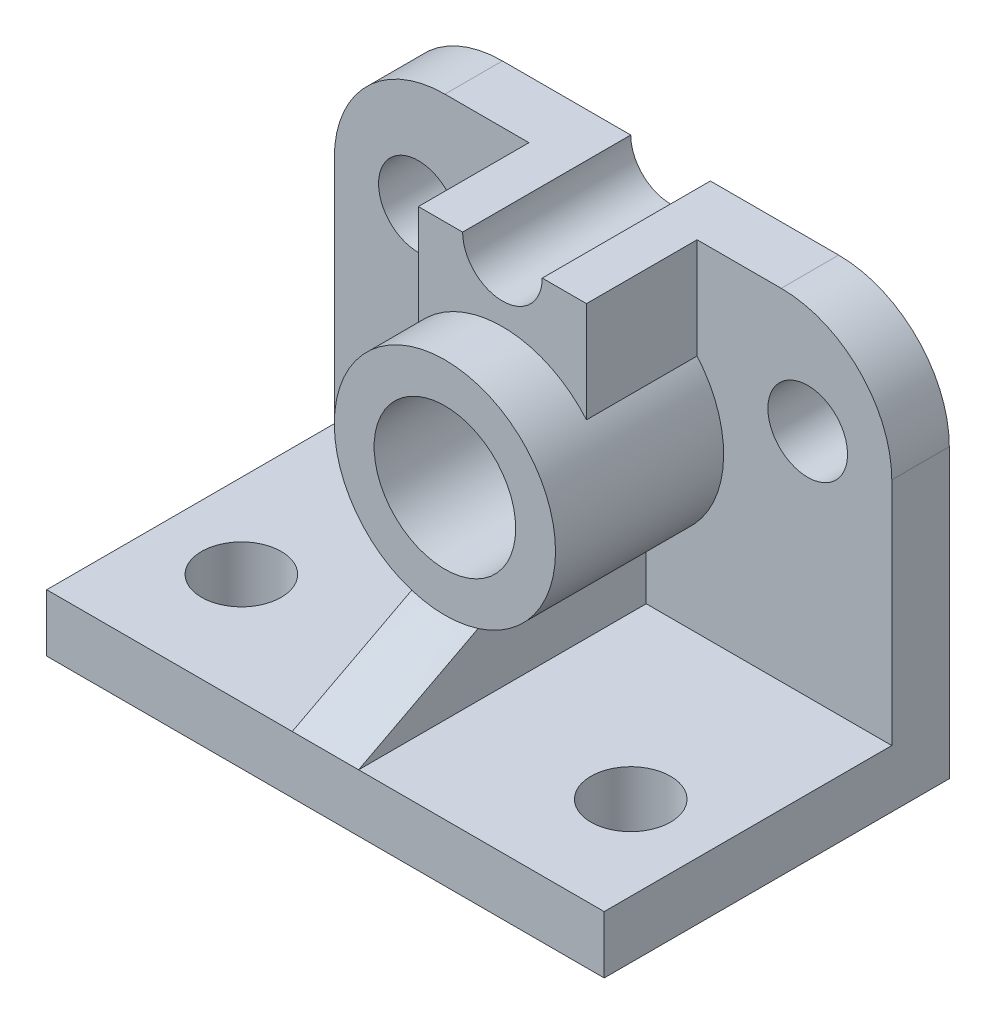
from build123d import *

# Parameters (mm, degrees)
SKETCH1_W           = 126
SKETCH1_H           = 13
BOSS_EXTRUDE1_DEPTH = 78
SKETCH1_3_R         = 9
BOSS_EXTRUDE2_DEPTH = 13
SKETCH1_4_R         = 25
SKETCH1_4_R_2       = 16
BOSS_EXTRUDE3_DEPTH = 51
BOSS_EXTRUDE4_DEPTH = 38
SKETCH2_R           = 9
CUT_EXTRUDE1_DEPTH  = 127.419935137
FILLET1_R           = 25


with BuildPart() as part:
    # Sketch1 → Boss-Extrude1 (new body)
    with BuildSketch(Plane.XY):
        Rectangle(SKETCH1_W, SKETCH1_H)
    extrude(amount=BOSS_EXTRUDE1_DEPTH)

    # Sketch1<3> → Boss-Extrude2 (add)
    with BuildSketch(Plane.XY):
        with BuildLine():
            Line((-63, 83.5), (-63, 6.5))
            Line((-63, 6.5), (63, 6.5))
            Line((63, 6.5), (63, 83.5))
            Line((63, 83.5), (19, 83.5))
            Line((19, 83.5), (19, 60.748076809))
            ThreePointArc((19, 60.748076809), (23.452078799, 53.160254038), (25, 44.5))
            ThreePointArc((25, 44.5), (-8.660254038, 21.047921201), (-19, 60.748076809))
            Line((-19, 60.748076809), (-19, 83.5))
            Line((-19, 83.5), (-63, 83.5))
        make_face()
        with Locations(Location((-44, 58.5, 0), (0, 0, 180))):
            Circle(SKETCH1_3_R, mode=Mode.SUBTRACT)
        with Locations(Location((44, 58.5, 0), (0, 0, 180))):
            Circle(SKETCH1_3_R, mode=Mode.SUBTRACT)
    extrude(amount=BOSS_EXTRUDE2_DEPTH)

    # Sketch1<4> → Boss-Extrude3 (add)
    with BuildSketch(Plane.XY):
        with Locations(Location((0, 44.5, 0), (0, 0, 139.464197889))):
            Circle(SKETCH1_4_R)
        with Locations((0, 44.5)):
            Circle(SKETCH1_4_R_2, mode=Mode.SUBTRACT)
    extrude(amount=BOSS_EXTRUDE3_DEPTH)

    # Sketch1<5> → Boss-Extrude4 (add)
    with BuildSketch(Plane.XY):
        with BuildLine():
            Line((-9, 83.5), (-19, 83.5))
            Line((-19, 83.5), (-19, 60.748076809))
            ThreePointArc((-19, 60.748076809), (0, 69.5), (19, 60.748076809))
            Line((19, 60.748076809), (19, 83.5))
            Line((19, 83.5), (9, 83.5))
            ThreePointArc((9, 83.5), (0, 74.5), (-9, 83.5))
        make_face()
    extrude(amount=BOSS_EXTRUDE4_DEPTH)

    # Sketch2 → Cut-Extrude1 (cut, through all)
    with BuildSketch(Plane(origin=(0, 6.5, 0), x_dir=(1, 0, 0), z_dir=(0, 1, 0))):
        with Locations(Location((-44, -53, 0), (0, 0, 270))):
            Circle(SKETCH2_R)
        with Locations(Location((44, -53, 0), (0, 0, 90))):
            Circle(SKETCH2_R)
    extrude(amount=-CUT_EXTRUDE1_DEPTH, mode=Mode.SUBTRACT)

    # Fillet1
    fillet1_edges = [part.edges().sort_by_distance(p)[0] for p in [
        (-63, 83.5, 6.5),
        (63, 83.5, 6.5),
    ]]
    fillet(fillet1_edges, radius=FILLET1_R)

    # Sketch4 → Loft4 section 0
    with BuildSketch(Plane(origin=(-7.5, 0, 0), x_dir=(0, 0, -1), z_dir=(1, 0, 0))):
        with BuildLine():
            Line((-78, 6.5), (-51, 20.651519965))
            Line((-51, 20.651519965), (-13, 20.651519965))
            Line((-13, 20.651519965), (-13, 6.5))
            Line((-13, 6.5), (-78, 6.5))
        make_face()
    # Sketch6 → Loft4 section 1
    with BuildSketch(Plane(origin=(0, 0, 0), x_dir=(0, 0, -1), z_dir=(1, 0, 0))):
        with BuildLine():
            Line((-78, 6.5), (-51, 19.5))
            Line((-51, 19.5), (-13, 19.5))
            Line((-13, 19.5), (-13, 6.5))
            Line((-13, 6.5), (-78, 6.5))
        make_face()
    # Sketch5 → Loft4 section 2
    with BuildSketch(Plane(origin=(7.5, 0, 0), x_dir=(0, 0, -1), z_dir=(1, 0, 0))):
        with BuildLine():
            Line((-78, 6.5), (-51, 20.651519965))
            Line((-51, 20.651519965), (-13, 20.651519965))
            Line((-13, 20.651519965), (-13, 6.5))
            Line((-13, 6.5), (-78, 6.5))
        make_face()
    loft()


solid = part.part
